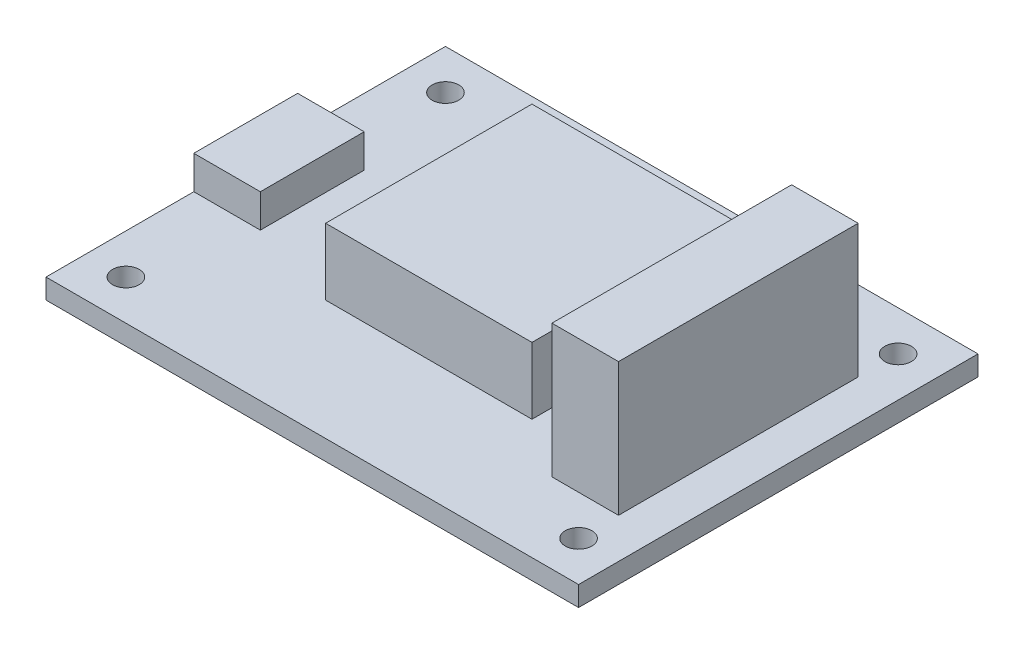
from build123d import *

# Parameters (mm, degrees)
SKETCH_1_W      = 40
SKETCH_1_H      = 30
SKETCH_1_R      = 1
EXTRUDE_1_DEPTH = 1.5
SKETCH_2_W      = 5
SKETCH_2_H      = 7.8
EXTRUDE_2_DEPTH = 2.5
SKETCH_3_W      = 15.5
SKETCH_3_H      = 15.5
EXTRUDE_3_DEPTH = 5
SKETCH_4_W      = 5
SKETCH_4_H      = 18
EXTRUDE_4_DEPTH = 10


with BuildPart() as part:
    # 草图1 → 凸台-拉伸1 (new body)
    with BuildSketch(Plane(origin=(0, 0, 0), x_dir=(1, 0, 0), z_dir=(0, 1, 0))):
        Rectangle(SKETCH_1_W, SKETCH_1_H)
        with Locations(Location((-17, 12, 0), (0, 0, 270))):
            Circle(SKETCH_1_R, mode=Mode.SUBTRACT)
        with Locations(Location((17, 12, 0), (0, 0, 90))):
            Circle(SKETCH_1_R, mode=Mode.SUBTRACT)
        with Locations(Location((17, -12, 0), (0, 0, 270))):
            Circle(SKETCH_1_R, mode=Mode.SUBTRACT)
        with Locations(Location((-17, -12, 0), (0, 0, 90))):
            Circle(SKETCH_1_R, mode=Mode.SUBTRACT)
    extrude(amount=EXTRUDE_1_DEPTH)

    # 草图2 → 凸台-拉伸2 (add)
    with BuildSketch(Plane(origin=(0, 1.5, 0), x_dir=(1, 0, 0), z_dir=(0, 1, 0))):
        with Locations((-17.5, 0)):
            Rectangle(SKETCH_2_W, SKETCH_2_H)
    extrude(amount=EXTRUDE_2_DEPTH)

    # 草图3 → 凸台-拉伸3 (add)
    with BuildSketch(Plane(origin=(0, 1.5, 0), x_dir=(1, 0, 0), z_dir=(0, 1, 0))):
        with Locations((-0.25, 1.75)):
            Rectangle(SKETCH_3_W, SKETCH_3_H)
    extrude(amount=EXTRUDE_3_DEPTH)

    # 草图4 → 凸台-拉伸4 (add)
    with BuildSketch(Plane(origin=(0, 1.5, 0), x_dir=(1, 0, 0), z_dir=(0, 1, 0))):
        with Locations((14.5, 0)):
            Rectangle(SKETCH_4_W, SKETCH_4_H)
    extrude(amount=EXTRUDE_4_DEPTH)


solid = part.part
